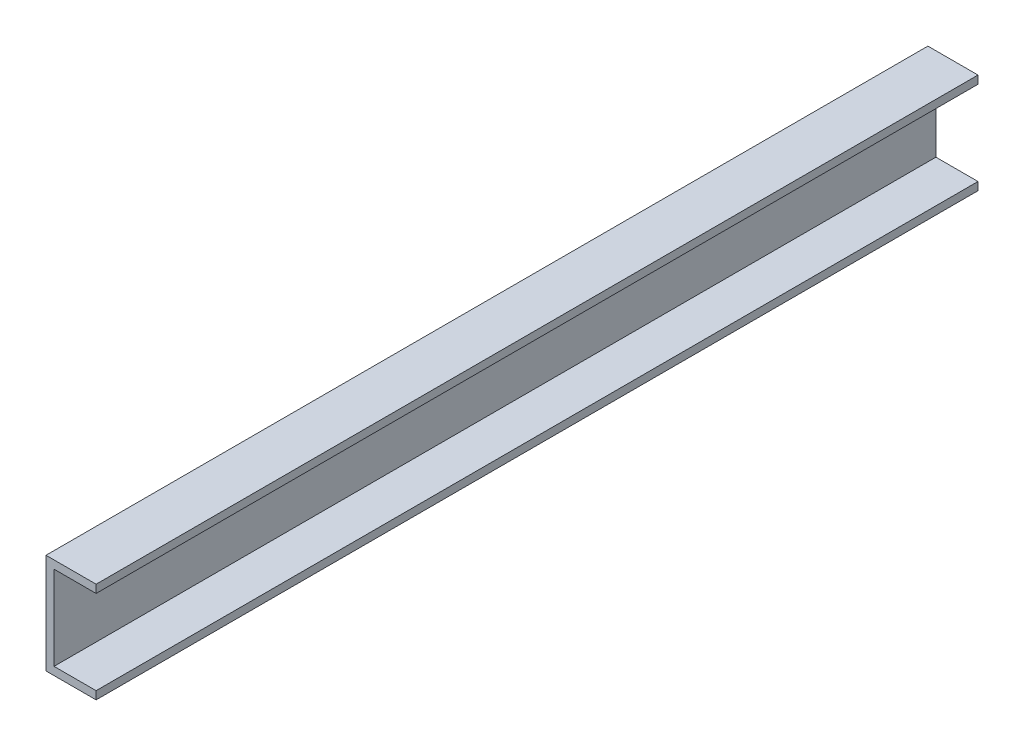
from build123d import *

# Parameters (mm, degrees)
BOSS_EXTRUDE1_DEPTH = 880


with BuildPart() as part:
    # Sketch1 → Boss-Extrude1 (new body)
    with BuildSketch(Plane.XY):
        Polygon((0, 0), (0, -100), (50, -100), (50, -92), (8, -92), (8, -8), (50, -8), (50, 0), align=None)
    extrude(amount=BOSS_EXTRUDE1_DEPTH)


solid = part.part
